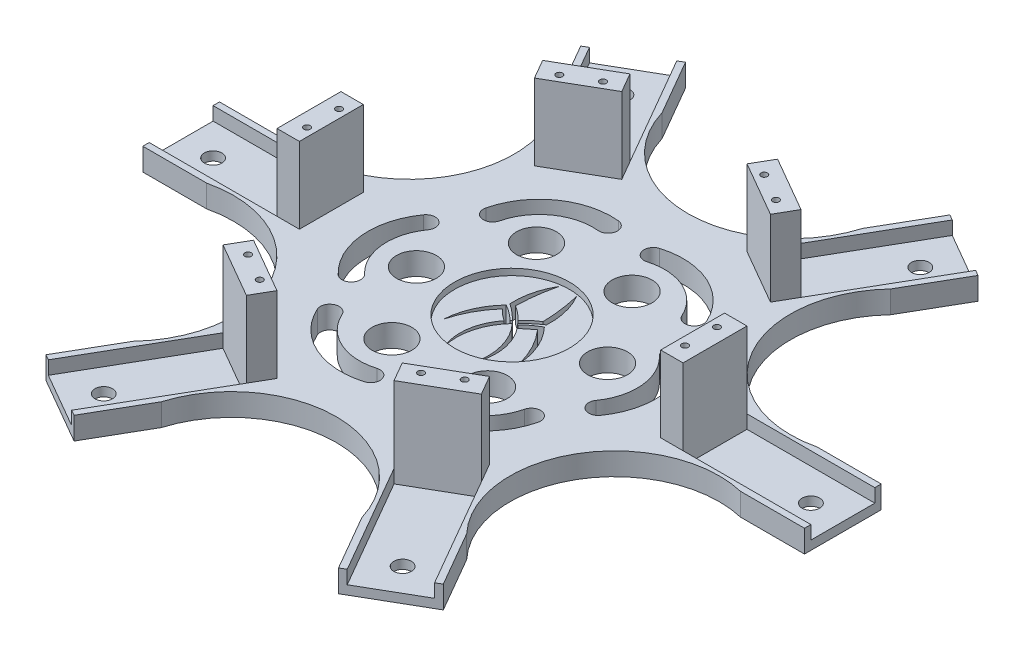
from build123d import *

# Parameters (mm, degrees)
BOSS_EXTRUDE2_DEPTH = 10
SKETCH2_W           = 30
SKETCH2_H           = 30
CUT_EXTRUDE1_DEPTH  = 3
SKETCH3_R           = 2.75
BOSS_EXTRUDE3_DEPTH = 3
SKETCH4_W           = 20
SKETCH4_H           = 5.795716055
CUT_EXTRUDE2_DEPTH  = 40
SKETCH5_W           = 7
SKETCH5_H           = 20
SKETCH5_R           = 1
BOSS_EXTRUDE5_DEPTH = 23.8
SKETCH7_R           = 17.956548638
CUT_EXTRUDE3_DEPTH  = 2
CIRPATTERN1_COUNT   = 6
CUT_EXTRUDE4_DEPTH  = 10
CIRPATTERN2_COUNT   = 6
SKETCH10_R          = 6.228414707
CUT_EXTRUDE5_DEPTH  = 10
CIRPATTERN3_COUNT   = 6
SKETCH11_R          = 76.71316325
CUT_EXTRUDE6_DEPTH  = 3
SKETCH3_3_R         = 2.75
CUT_EXTRUDE14_DEPTH = 10
CIRPATTERN4_COUNT   = 6
CUT_EXTRUDE15_DEPTH = 10


with BuildPart() as part:
    # Sketch1 → Boss-Extrude2 (new body)
    with BuildSketch(Plane(origin=(0, 0, 0), x_dir=(1, 0, 0), z_dir=(0, 1, 0))):
        with BuildLine():
            Line((42.146569651, -49), (44.630383138, -53.302091156))
            ThreePointArc((44.630383138, -53.302091156), (47.631397208, -27.5), (68.476156585, -12))
            Line((68.476156585, -12), (63.508529611, -12))
            Line((63.508529611, -12), (63.508529611, 12))
            Line((63.508529611, 12), (68.476156585, 12))
            ThreePointArc((68.476156585, 12), (47.631397208, 27.5), (44.630383138, 53.302091156))
            Line((44.630383138, 53.302091156), (42.146569651, 49))
            Line((42.146569651, 49), (21.36195996, 61))
            Line((21.36195996, 61), (23.845773447, 65.302091156))
            ThreePointArc((23.845773447, 65.302091156), (0, 55), (-23.845773447, 65.302091156))
            Line((-23.845773447, 65.302091156), (-21.36195996, 61))
            Line((-21.36195996, 61), (-42.146569651, 49))
            Line((-42.146569651, 49), (-44.630383138, 53.302091156))
            ThreePointArc((-44.630383138, 53.302091156), (-47.631397208, 27.5), (-68.476156585, 12))
            Line((-68.476156585, 12), (-63.508529611, 12))
            Line((-63.508529611, 12), (-63.508529611, -12))
            Line((-63.508529611, -12), (-68.476156585, -12))
            ThreePointArc((-68.476156585, -12), (-47.631397208, -27.5), (-44.630383138, -53.302091156))
            Line((-44.630383138, -53.302091156), (-42.146569651, -49))
            Line((-42.146569651, -49), (-21.36195996, -61))
            Line((-21.36195996, -61), (-23.845773447, -65.302091156))
            ThreePointArc((-23.845773447, -65.302091156), (0, -55), (23.845773447, -65.302091156))
            Line((23.845773447, -65.302091156), (21.36195996, -61))
            Line((21.36195996, -61), (42.146569651, -49))
        make_face()
        with BuildLine():
            Line((-21.36195996, 61), (-23.845773447, 65.302091156))
            ThreePointArc((-23.845773447, 65.302091156), (-28.36094589, 71.374199744), (-31.36195996, 78.320508076))
            Line((-31.36195996, 78.320508076), (-41.36195996, 95.641016151))
            Line((-41.36195996, 95.641016151), (-62.146569651, 83.641016151))
            Line((-62.146569651, 83.641016151), (-52.146569651, 66.320508076))
            ThreePointArc((-52.146569651, 66.320508076), (-47.631397208, 60.248399488), (-44.630383138, 53.302091156))
            Line((-44.630383138, 53.302091156), (-42.146569651, 49))
            Line((-42.146569651, 49), (-21.36195996, 61))
        make_face()
        with BuildLine():
            Line((42.146569651, 49), (44.630383138, 53.302091156))
            ThreePointArc((44.630383138, 53.302091156), (47.631397208, 60.248399488), (52.146569651, 66.320508076))
            Line((52.146569651, 66.320508076), (62.146569651, 83.641016151))
            Line((62.146569651, 83.641016151), (41.36195996, 95.641016151))
            Line((41.36195996, 95.641016151), (31.36195996, 78.320508076))
            ThreePointArc((31.36195996, 78.320508076), (28.36094589, 71.374199744), (23.845773447, 65.302091156))
            Line((23.845773447, 65.302091156), (21.36195996, 61))
            Line((21.36195996, 61), (42.146569651, 49))
        make_face()
        with BuildLine():
            ThreePointArc((-83.508529611, -12), (-75.992343098, -11.125800256), (-68.476156585, -12))
            Line((-68.476156585, -12), (-63.508529611, -12))
            Line((-63.508529611, -12), (-63.508529611, 12))
            Line((-63.508529611, 12), (-68.476156585, 12))
            ThreePointArc((-68.476156585, 12), (-75.992343098, 11.125800256), (-83.508529611, 12))
            Line((-83.508529611, 12), (-103.508529611, 12))
            Line((-103.508529611, 12), (-103.508529611, -12))
            Line((-103.508529611, -12), (-83.508529611, -12))
        make_face()
        with BuildLine():
            ThreePointArc((-31.36195996, -78.320508076), (-28.36094589, -71.374199744), (-23.845773447, -65.302091156))
            Line((-23.845773447, -65.302091156), (-21.36195996, -61))
            Line((-21.36195996, -61), (-42.146569651, -49))
            Line((-42.146569651, -49), (-44.630383138, -53.302091156))
            ThreePointArc((-44.630383138, -53.302091156), (-47.631397208, -60.248399488), (-52.146569651, -66.320508076))
            Line((-52.146569651, -66.320508076), (-62.146569651, -83.641016151))
            Line((-62.146569651, -83.641016151), (-41.36195996, -95.641016151))
            Line((-41.36195996, -95.641016151), (-31.36195996, -78.320508076))
        make_face()
        with BuildLine():
            Line((41.36195996, -95.641016151), (62.146569651, -83.641016151))
            Line((62.146569651, -83.641016151), (52.146569651, -66.320508076))
            ThreePointArc((52.146569651, -66.320508076), (47.631397208, -60.248399488), (44.630383138, -53.302091156))
            Line((44.630383138, -53.302091156), (42.146569651, -49))
            Line((42.146569651, -49), (21.36195996, -61))
            Line((21.36195996, -61), (23.845773447, -65.302091156))
            ThreePointArc((23.845773447, -65.302091156), (28.36094589, -71.374199744), (31.36195996, -78.320508076))
            Line((31.36195996, -78.320508076), (41.36195996, -95.641016151))
        make_face()
        with BuildLine():
            Line((63.508529611, -12), (68.476156585, -12))
            ThreePointArc((68.476156585, -12), (75.992343098, -11.125800256), (83.508529611, -12))
            Line((83.508529611, -12), (103.508529611, -12))
            Line((103.508529611, -12), (103.508529611, 12))
            Line((103.508529611, 12), (83.508529611, 12))
            ThreePointArc((83.508529611, 12), (75.992343098, 11.125800256), (68.476156585, 12))
            Line((68.476156585, 12), (63.508529611, 12))
            Line((63.508529611, 12), (63.508529611, -12))
        make_face()
    extrude(amount=BOSS_EXTRUDE2_DEPTH)

    # Sketch2 → Cut-Extrude1 (cut)
    with BuildSketch(Plane.XZ):
        with Locations((88.508529611, 0)):
            Rectangle(SKETCH2_W, SKETCH2_H)
    cut_extrude1 = extrude(amount=-CUT_EXTRUDE1_DEPTH, mode=Mode.SUBTRACT)

    # Sketch3 → Boss-Extrude3 (add)
    with BuildSketch(Plane.XZ.offset(-3)):
        with Locations(Location((93.508529611, 0, 0), (0, 0, 270))):
            Circle(SKETCH3_R)
    boss_extrude3 = extrude(amount=BOSS_EXTRUDE3_DEPTH)

    # Sketch4 → Cut-Extrude2 (cut)
    with BuildSketch(Plane(origin=(103.508529611, 0, 0), x_dir=(0, 0, -1), z_dir=(1, 0, 0))):
        with Locations((0, 8.697858028)):
            Rectangle(SKETCH4_W, SKETCH4_H)
    cut_extrude2 = extrude(amount=-CUT_EXTRUDE2_DEPTH, mode=Mode.SUBTRACT)

    # Sketch5 → Boss-Extrude5 (add)
    with BuildSketch(Plane(origin=(0, 10, 0), x_dir=(1, 0, 0), z_dir=(0, 1, 0))):
        with Locations((60.008529611, 0)):
            Rectangle(SKETCH5_W, SKETCH5_H)
        with Locations(Location((59.108529611, 5, 0), (0, 0, 270))):
            Circle(SKETCH5_R, mode=Mode.SUBTRACT)
        with Locations(Location((59.108529611, -5, 0), (0, 0, 270))):
            Circle(SKETCH5_R, mode=Mode.SUBTRACT)
    boss_extrude5 = extrude(amount=BOSS_EXTRUDE5_DEPTH)

    # Sketch7 → Cut-Extrude3 (cut)
    with BuildSketch(Plane(origin=(0, 10, 0), x_dir=(1, 0, 0), z_dir=(0, 1, 0))):
        with Locations(Location((0, 0, 0), (0, 0, 270))):
            Circle(SKETCH7_R)
    extrude(amount=-CUT_EXTRUDE3_DEPTH, mode=Mode.SUBTRACT)

    # CirPattern1: Cut-Extrude1, Boss-Extrude3, Cut-Extrude2, Boss-Extrude5 ×6 about axis
    cirpattern1_axis = Axis((0, 0, 0), (0, 1, 0))
    add([cut_extrude1.rotate(cirpattern1_axis, i * 360 / CIRPATTERN1_COUNT) for i in range(1, CIRPATTERN1_COUNT)], mode=Mode.SUBTRACT)
    add([boss_extrude3.rotate(cirpattern1_axis, i * 360 / CIRPATTERN1_COUNT) for i in range(1, CIRPATTERN1_COUNT)])
    add([cut_extrude2.rotate(cirpattern1_axis, i * 360 / CIRPATTERN1_COUNT) for i in range(1, CIRPATTERN1_COUNT)], mode=Mode.SUBTRACT)
    add([boss_extrude5.rotate(cirpattern1_axis, i * 360 / CIRPATTERN1_COUNT) for i in range(1, CIRPATTERN1_COUNT)])

    # Sketch9 → Cut-Extrude4 (cut)
    with BuildSketch(Plane(origin=(0, 10, 0), x_dir=(1, 0, 0), z_dir=(0, 1, 0))):
        with BuildLine():
            ThreePointArc((-40.997525899, 13.361217149), (-45.122651609, -1.959571786), (-38.168577752, -16.22085127))
            ThreePointArc((-38.168577752, -16.22085127), (-34.036830238, -16.110717076), (-34.146964432, -11.978969562))
            ThreePointArc((-34.146964432, -11.978969562), (-39.303948786, -1.403126296), (-36.244848583, 9.958425287))
            ThreePointArc((-36.244848583, 9.958425287), (-36.91979131, 14.036159876), (-40.997525899, 13.361217149))
        make_face()
    cut_extrude4 = extrude(amount=-CUT_EXTRUDE4_DEPTH, mode=Mode.SUBTRACT)

    # CirPattern2: Cut-Extrude4 ×6 about axis
    cirpattern2_axis = Axis((0, 0, 0), (0, 1, 0))
    for i in range(1, CIRPATTERN2_COUNT):
        add(cut_extrude4.rotate(cirpattern2_axis, i * 360 / CIRPATTERN2_COUNT), mode=Mode.SUBTRACT)

    # Sketch10 → Cut-Extrude5 (cut)
    with BuildSketch(Plane(origin=(0, 10, 0), x_dir=(1, 0, 0), z_dir=(0, 1, 0))):
        with Locations(Location((-15.644793765, 23.307866185, 0), (0, 0, 270))):
            Circle(SKETCH10_R)
    cut_extrude5 = extrude(amount=-CUT_EXTRUDE5_DEPTH, mode=Mode.SUBTRACT)

    # CirPattern3: Cut-Extrude5 ×6 about axis
    cirpattern3_axis = Axis((0, 0, 0), (0, 1, 0))
    for i in range(1, CIRPATTERN3_COUNT):
        add(cut_extrude5.rotate(cirpattern3_axis, i * 360 / CIRPATTERN3_COUNT), mode=Mode.SUBTRACT)

    # Sketch11 → Cut-Extrude6 (cut)
    with BuildSketch(Plane.XZ):
        Circle(SKETCH11_R)
    extrude(amount=-CUT_EXTRUDE6_DEPTH, mode=Mode.SUBTRACT)

    # Sketch3<3> → Cut-Extrude14 (cut, symmetric)
    with BuildSketch(Plane.XZ.offset(-3)):
        with Locations(Location((93.508529611, 0, 0), (0, 0, 270))):
            Circle(SKETCH3_3_R)
    cut_extrude14 = extrude(amount=CUT_EXTRUDE14_DEPTH, both=True, mode=Mode.SUBTRACT)

    # CirPattern4: Cut-Extrude14 ×6 about axis
    cirpattern4_axis = Axis((0, 0, 0), (0, 1, 0))
    for i in range(1, CIRPATTERN4_COUNT):
        add(cut_extrude14.rotate(cirpattern4_axis, i * 360 / CIRPATTERN4_COUNT), mode=Mode.SUBTRACT)

    # Sketch12 → Cut-Extrude15 (cut)
    with BuildSketch(Plane(origin=(0, 8, 0), x_dir=(1, 0, 0), z_dir=(0, 1, 0))):
        with BuildLine():
            Line((-0.48650389, 0.580267891), (-0.868237132, 0.26885393))
            ThreePointArc((-0.868237132, 0.26885393), (-3.132124126, 2.210554987), (-5.639902659, 3.825000448))
            ThreePointArc((-5.639902659, 3.825000448), (-9.832088982, -2.491482457), (-11.607932051, -9.861608906))
            ThreePointArc((-11.607932051, -9.861608906), (-9.121646547, -3.467956829), (-5.20047487, 2.160969814))
            ThreePointArc((-5.20047487, 2.160969814), (-3.542572487, 0.594754735), (-1.702042315, -0.752137492))
            ThreePointArc((-1.702042315, -0.752137492), (-5.116519346, -8.499623881), (-4.175826891, -16.913736814))
            ThreePointArc((-4.175826891, -16.913736814), (-4.013562599, -8.021116947), (0.332405604, -0.261118352))
            ThreePointArc((0.332405604, -0.261118352), (4.678373806, -8.021116947), (4.840638099, -16.913736814))
            ThreePointArc((4.840638099, -16.913736814), (5.781330553, -8.499623881), (2.366853522, -0.752137492))
            ThreePointArc((2.366853522, -0.752137492), (4.207383695, 0.594754735), (5.865286077, 2.160969814))
            ThreePointArc((5.865286077, 2.160969814), (9.786457755, -3.467956829), (12.272743259, -9.861608906))
            ThreePointArc((12.272743259, -9.861608906), (10.49690019, -2.491482457), (6.304713866, 3.825000448))
            ThreePointArc((6.304713866, 3.825000448), (3.796935333, 2.210554987), (1.53304834, 0.26885393))
            Line((1.53304834, 0.26885393), (1.151315098, 0.580267891))
            ThreePointArc((1.151315098, 0.580267891), (3.489581312, 2.803047317), (6.065700849, 4.745171256))
            ThreePointArc((6.065700849, 4.745171256), (5.467595586, 11.17994434), (3.047531408, 17.172216357))
            ThreePointArc((3.047531408, 17.172216357), (4.168184493, 11.166570853), (4.637644142, 5.07532723))
            ThreePointArc((4.637644142, 5.07532723), (2.367927248, 3.446046344), (0.332405604, 1.532196134))
            ThreePointArc((0.332405604, 1.532196134), (-1.70311604, 3.446046344), (-3.972832935, 5.07532723))
            ThreePointArc((-3.972832935, 5.07532723), (-3.503373285, 11.166570853), (-2.3827202, 17.172216357))
            ThreePointArc((-2.3827202, 17.172216357), (-4.802784379, 11.17994434), (-5.400889642, 4.745171256))
            ThreePointArc((-5.400889642, 4.745171256), (-2.824770104, 2.803047317), (-0.48650389, 0.580267891))
        make_face()
    extrude(amount=-CUT_EXTRUDE15_DEPTH, mode=Mode.SUBTRACT)


solid = part.part
